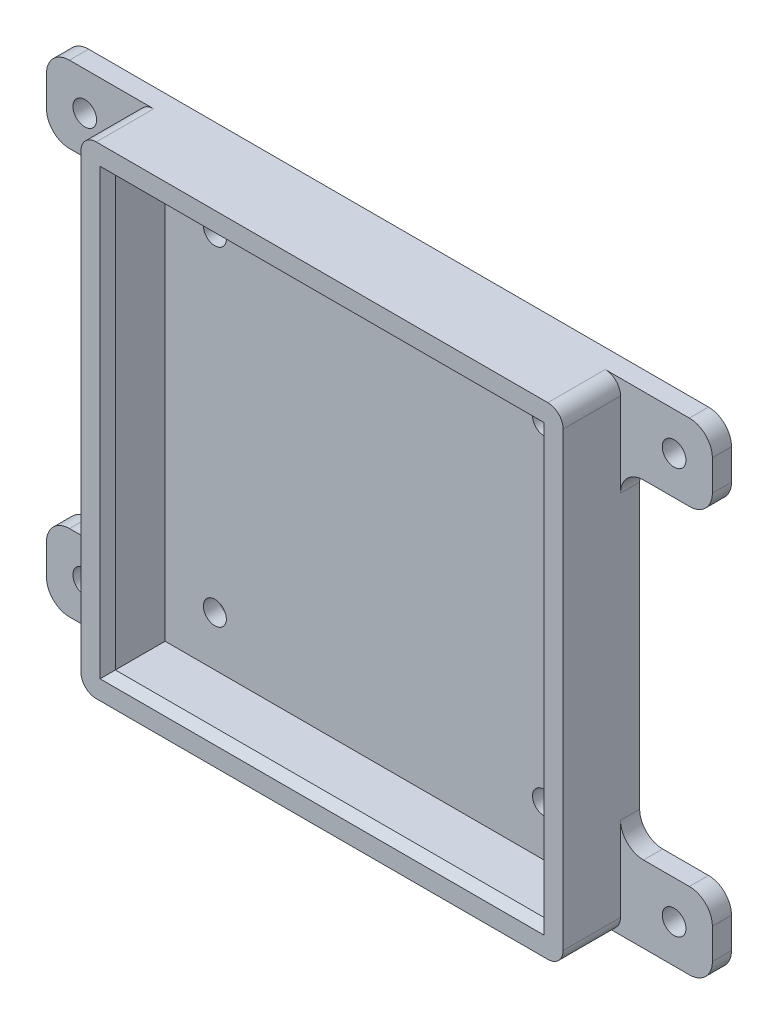
from build123d import *

# Parameters (mm, degrees)
SKETCH1_W               = 63
SKETCH1_H               = 63
SKETCH1_W_2             = 56
SKETCH1_H_2             = 56
SKETCH1_W_3             = 12
SKETCH1_H_3             = 10
SKETCH1_R               = 1.55
BOSS_EXTRUDE1_DEPTH     = 2.5
SKETCH1_3_W             = 63
SKETCH1_3_H             = 63
SKETCH1_3_W_2           = 56
SKETCH1_3_H_2           = 56
BOSS_EXTRUDE2_DEPTH     = 10
SKETCH1_4_W             = 12
SKETCH1_4_H             = 10
SKETCH1_4_R             = 1.55
BOSS_EXTRUDE3_DEPTH     = 2
FILLET1_R               = 3
FILLET2_R               = 2
CHAMFER1_SIZE           = 1
CUT_EXTRUDE1_DEPTH      = 85.288196089
CUT_EXTRUDE1_DEPTH_BACK = 85.288196089
SKETCH2_R               = 1.5
FILLET3_R               = 0.5


with BuildPart() as part:
    # Sketch1 → Boss-Extrude1 (new body)
    # profile 1 of 6: a face of its own
    with BuildSketch(Plane.XY):
        with Locations((0, -40)):
            Rectangle(SKETCH1_W, SKETCH1_H)
        with Locations((0, -40)):
            Rectangle(SKETCH1_W_2, SKETCH1_H_2, mode=Mode.SUBTRACT)
    # profile 2 of 6: a face of its own
    with BuildSketch(Plane.XY):
        with Locations((0, -40)):
            Rectangle(SKETCH1_W_2, SKETCH1_H_2)
    # profile 3 of 6: a face of its own
    with BuildSketch(Plane.XY):
        with Locations((37.5, -13.5)):
            Rectangle(SKETCH1_W_3, SKETCH1_H_3)
        with Locations((38.5, -13.5)):
            Circle(SKETCH1_R, mode=Mode.SUBTRACT)
    # profile 4 of 6: a face of its own
    with BuildSketch(Plane.XY):
        with Locations((37.5, -66.5)):
            Rectangle(SKETCH1_W_3, SKETCH1_H_3)
        with Locations((38.5, -66.5)):
            Circle(SKETCH1_R, mode=Mode.SUBTRACT)
    # profile 5 of 6: a face of its own
    with BuildSketch(Plane.XY):
        with Locations((-37.5, -66.5)):
            Rectangle(SKETCH1_W_3, SKETCH1_H_3)
        with Locations((-38.5, -66.5)):
            Circle(SKETCH1_R, mode=Mode.SUBTRACT)
    # profile 6 of 6: a face of its own
    with BuildSketch(Plane.XY):
        with Locations((-37.5, -13.5)):
            Rectangle(SKETCH1_W_3, SKETCH1_H_3)
        with Locations((-38.5, -13.5)):
            Circle(SKETCH1_R, mode=Mode.SUBTRACT)
    extrude(amount=BOSS_EXTRUDE1_DEPTH)

    # Sketch1<3> → Boss-Extrude2 (add)
    with BuildSketch(Plane.XY):
        with Locations((0, -40)):
            Rectangle(SKETCH1_3_W, SKETCH1_3_H)
        with Locations((0, -40)):
            Rectangle(SKETCH1_3_W_2, SKETCH1_3_H_2, mode=Mode.SUBTRACT)
    extrude(amount=BOSS_EXTRUDE2_DEPTH)

    # Sketch1<4> → Boss-Extrude3 (add)
    # profile 1 of 4: a face of its own
    with BuildSketch(Plane.XY):
        with Locations((-37.5, -66.5)):
            Rectangle(SKETCH1_4_W, SKETCH1_4_H)
        with Locations((-38.5, -66.5)):
            Circle(SKETCH1_4_R, mode=Mode.SUBTRACT)
    # profile 2 of 4: a face of its own
    with BuildSketch(Plane.XY):
        with Locations((-37.5, -13.5)):
            Rectangle(SKETCH1_4_W, SKETCH1_4_H)
        with Locations((-38.5, -13.5)):
            Circle(SKETCH1_4_R, mode=Mode.SUBTRACT)
    # profile 3 of 4: a face of its own
    with BuildSketch(Plane.XY):
        with Locations((37.5, -13.5)):
            Rectangle(SKETCH1_4_W, SKETCH1_4_H)
        with Locations((38.5, -13.5)):
            Circle(SKETCH1_4_R, mode=Mode.SUBTRACT)
    # profile 4 of 4: a face of its own
    with BuildSketch(Plane.XY):
        with Locations((37.5, -66.5)):
            Rectangle(SKETCH1_4_W, SKETCH1_4_H)
        with Locations((38.5, -66.5)):
            Circle(SKETCH1_4_R, mode=Mode.SUBTRACT)
    extrude(amount=BOSS_EXTRUDE3_DEPTH)

    # Fillet1
    fillet1_edges = [part.edges().sort_by_distance(p)[0] for p in [
        (-31.5, -18.5, 1.25),
        (-43.5, -18.5, 1.25),
        (-43.5, -8.5, 1.25),
        (43.5, -8.5, 1.25),
        (43.5, -18.5, 1.25),
        (31.5, -18.5, 1.25),
        (31.5, -61.5, 1.25),
        (43.5, -61.5, 1.25),
        (43.5, -71.5, 1.25),
        (-43.5, -71.5, 1.25),
        (-43.5, -61.5, 1.25),
        (-31.5, -61.5, 1.25),
    ]]
    fillet(fillet1_edges, radius=FILLET1_R)

    # Fillet2
    fillet2_edges = [part.edges().sort_by_distance(p)[0] for p in [
        (-31.5, -71.5, 6.25),
        (31.5, -8.5, 6.25),
        (-31.5, -8.5, 6.25),
        (31.5, -71.5, 6.25),
    ]]
    fillet(fillet2_edges, radius=FILLET2_R)

    # Chamfer1
    chamfer1_edges = [part.edges().sort_by_distance(p)[0] for p in [
        (28, -40, 10),
        (0, -68, 10),
        (-28, -40, 10),
        (0, -12, 10),
    ]]
    chamfer(chamfer1_edges, length=CHAMFER1_SIZE)

    # Sketch2 → Cut-Extrude1 (cut, two sides: drawn at the far end of the back side and taken through both)
    with BuildSketch(Plane(origin=(0, 0, 0), x_dir=(-1, 0, 0), z_dir=(0, 0, -1)).offset(-CUT_EXTRUDE1_DEPTH_BACK)):
        with Locations((-21.5, -18.5)):
            Circle(SKETCH2_R)
        with Locations((-21.5, -61.5)):
            Circle(SKETCH2_R)
        with Locations((21.5, -61.5)):
            Circle(SKETCH2_R)
        with Locations((21.5, -18.5)):
            Circle(SKETCH2_R)
    extrude(amount=CUT_EXTRUDE1_DEPTH + CUT_EXTRUDE1_DEPTH_BACK, mode=Mode.SUBTRACT)

    # Fillet3
    fillet3_edges = [part.edges().sort_by_distance(p)[0] for p in [
        (23, -61.5, 0),
        (-20, -61.5, 0),
        (23, -18.5, 0),
        (-20, -18.5, 0),
    ]]
    fillet(fillet3_edges, radius=FILLET3_R)


solid = part.part
